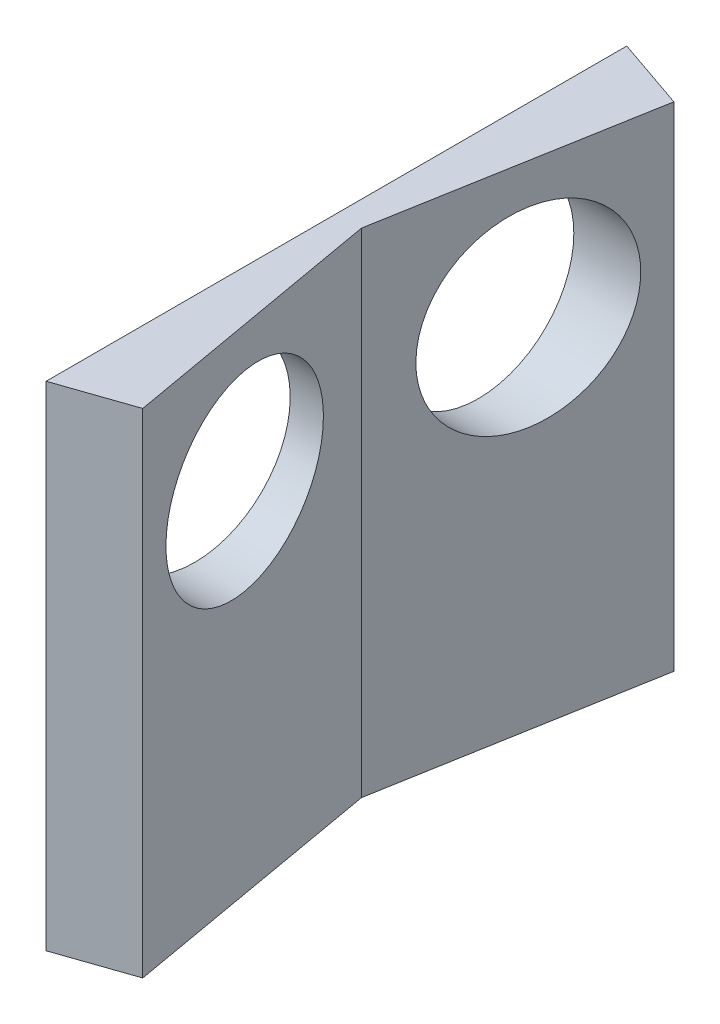
from build123d import *

# Parameters (mm, degrees)
BOSS_EXTRUDE2_DEPTH = 40
CUT_EXTRUDE1_REACH  = 48.78
SKETCH4_R           = 7.75


with BuildPart() as part:
    # Sketch3 → Boss-Extrude2 (new body)
    with BuildSketch(Plane(origin=(0, 0, 0), x_dir=(1, 0, 0), z_dir=(0, 1, 0))):
        Polygon((0, -23.54499856), (5.828357437, -21.536716606), (2.030853224, 0), (5.828357437, 21.536716606), (0, 23.54499856), align=None)
    extrude(amount=BOSS_EXTRUDE2_DEPTH)

    # Sketch4 → Cut-Extrude1 (cut, up to next)
    with BuildSketch(Plane.ZY, mode=Mode.PRIVATE) as cut_extrude1_sk1:
        with Locations((-11.5, 29)):
            Circle(SKETCH4_R)
    cut_extrude1_tool1 = extrude(cut_extrude1_sk1.sketch, amount=-CUT_EXTRUDE1_REACH, mode=Mode.PRIVATE) & part.part
    # Sketch4 → Cut-Extrude1 (cut, up to next)
    with BuildSketch(Plane.ZY, mode=Mode.PRIVATE) as cut_extrude1_sk2:
        with Locations((11.5, 29)):
            Circle(SKETCH4_R)
    cut_extrude1_tool2 = extrude(cut_extrude1_sk2.sketch, amount=-CUT_EXTRUDE1_REACH, mode=Mode.PRIVATE) & part.part
    add(cut_extrude1_tool1.solids().sort_by_distance((0, 29, -11.5))[0], mode=Mode.SUBTRACT)
    add(cut_extrude1_tool2.solids().sort_by_distance((0, 29, 11.5))[0], mode=Mode.SUBTRACT)


solid = part.part
